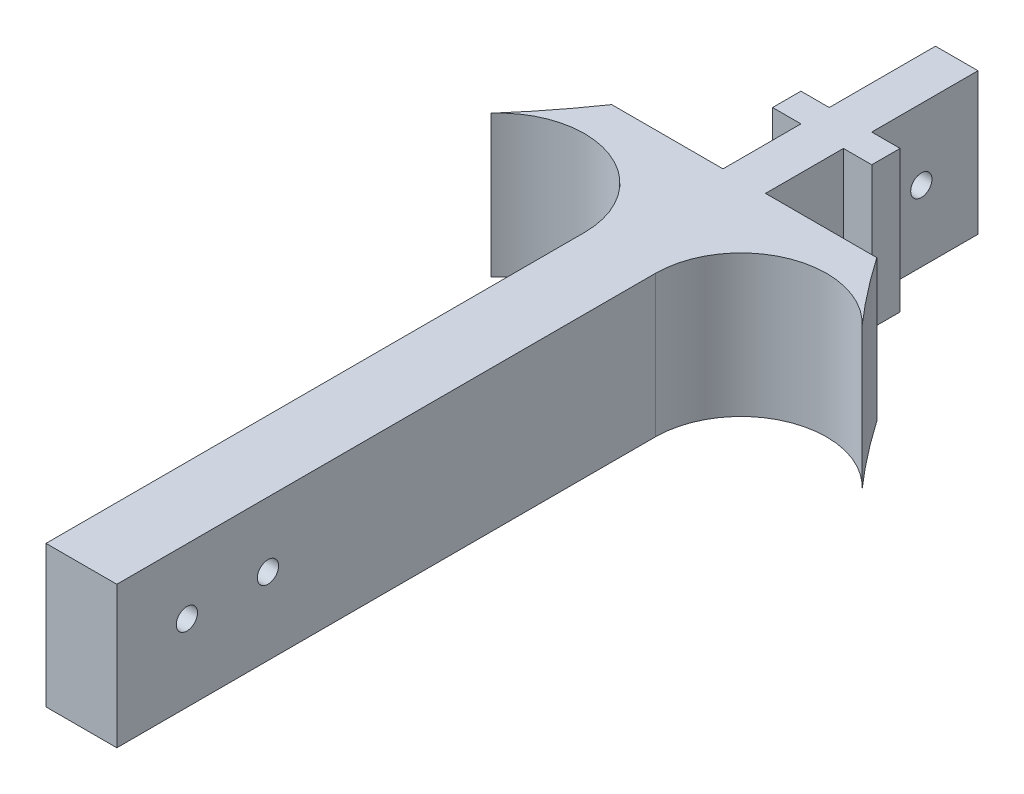
from build123d import *

# Parameters (mm, degrees)
BOSS_EXTRU_1_DEPTH      = 20
ESQUISSE3_R             = 1.5
ENL_V_MAT_EXTRU_3_DEPTH = 20
ESQUISSE4_R             = 1.5
ENL_V_MAT_EXTRU_4_DEPTH = 10
ESQUISSE5_R             = 1.5
ENL_V_MAT_EXTRU_5_DEPTH = 10


with BuildPart() as part:
    # Esquisse1 → Boss.-Extru.1 (new body)
    with BuildSketch(Plane(origin=(0, 0, 0), x_dir=(1, 0, 0), z_dir=(0, 1, 0))):
        with BuildLine():
            Line((-3, 84.398281038), (-3, 69.398281038))
            Line((-3, 69.398281038), (-7, 69.398281038))
            Line((-7, 69.398281038), (-7, 65.398281038))
            Line((-7, 65.398281038), (-3, 65.398281038))
            Line((-3, 65.398281038), (-3, 54.398281038))
            Line((-3, 54.398281038), (-18.71, 54.398281038))
            ThreePointArc((-18.71, 54.398281038), (-22.308577777, 49.499317693), (-26.183329952, 44.81574006))
            ThreePointArc((-26.183329952, 44.81574006), (-12.83252844, 48.159570073), (-5, 36.842476876))
            Line((-5, 36.842476876), (-5, -39.182739587))
            Line((-5, -39.182739587), (0, -39.182739587))
            Line((0, -39.182739587), (0, 84.398281038))
            Line((0, 84.398281038), (-3, 84.398281038))
        make_face()
    boss_extru_1 = extrude(amount=BOSS_EXTRU_1_DEPTH)

    # Symétrie1: Boss.-Extru.1 across plane
    add(boss_extru_1.mirror(Plane(origin=(0, 20, -84.398281038), x_dir=(0, 0, 1), z_dir=(-1, 0, 0))))

    # Esquisse3 → Enlèv. mat.-Extru.3 (cut)
    with BuildSketch(Plane.ZY.offset(3)):
        with Locations((-76.398281038, 10)):
            Circle(ESQUISSE3_R)
        with Locations((-60.398281038, 10)):
            Circle(ESQUISSE3_R)
    extrude(amount=-ENL_V_MAT_EXTRU_3_DEPTH, mode=Mode.SUBTRACT)

    # Esquisse4 → Enlèv. mat.-Extru.4 (cut)
    with BuildSketch(Plane.ZY.offset(5)):
        with Locations((29.291975875, 10.84)):
            Circle(ESQUISSE4_R)
    extrude(amount=-ENL_V_MAT_EXTRU_4_DEPTH, mode=Mode.SUBTRACT)

    # Esquisse5 → Enlèv. mat.-Extru.5 (cut)
    with BuildSketch(Plane.ZY.offset(5)):
        with Locations((17.841975875, 10.84)):
            Circle(ESQUISSE5_R)
    extrude(amount=-ENL_V_MAT_EXTRU_5_DEPTH, mode=Mode.SUBTRACT)


solid = part.part
